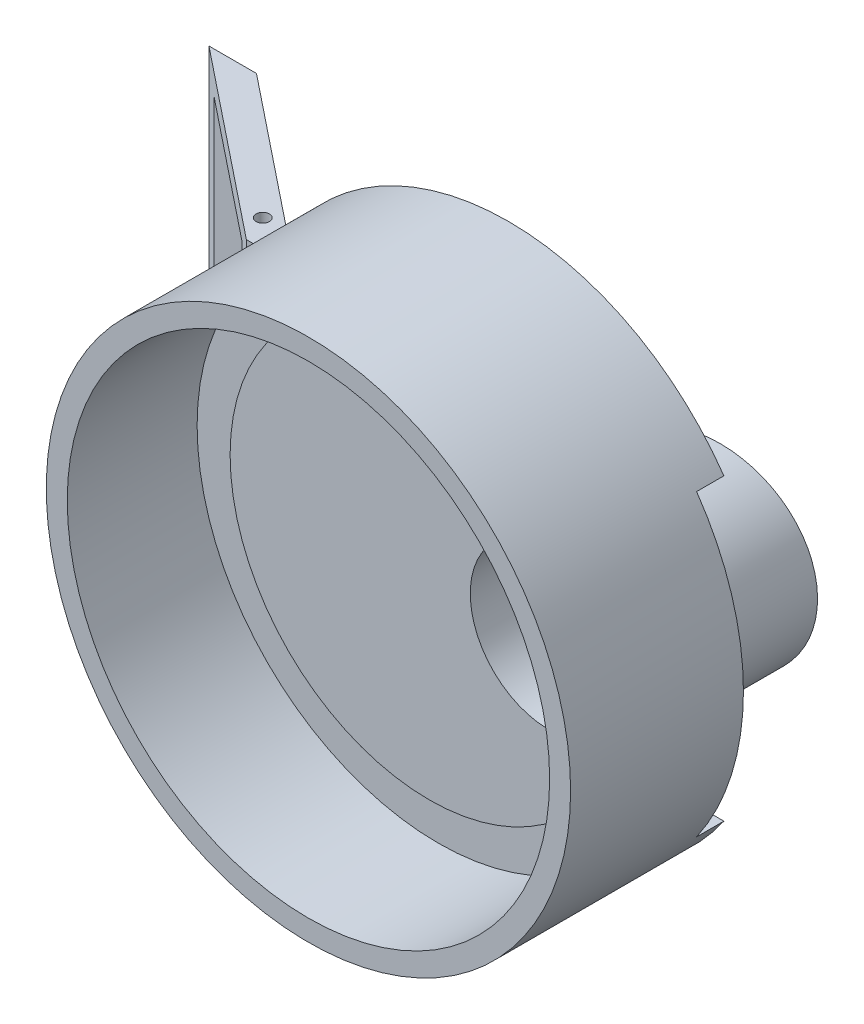
from build123d import *

# Parameters (mm, degrees)
SKETCH2_R                   = 9.525
LID_HOLE_DEPTH              = 50.8
SKETCH5_R                   = 12.065
LID_MOUTHPIECE_DEPTH        = 13.97
SKETCH6_R                   = 9.525
LID_HOLE_2_DEPTH            = 59.953263205
LID_HANDLE_DEPTH            = 13.97
SLOT_START                  = -3.302
SKETCH11_R                  = 12.065
SLOT_FOR_COVER_DEPTH        = 3.302
ANGLED_MOUTHPIECE_CUT_DEPTH = 12.7
CUT_EXTRUDE3_START          = -27.94
SKETCH15_R                  = 0.811013261
CUT_EXTRUDE3_DEPTH          = 27.94


with BuildPart() as part:
    # Sketch1 → Lid Shape (revolve)
    with BuildSketch(Plane(origin=(0, 0, 0), x_dir=(1, 0, 0), z_dir=(0, 1, 0))):
        Polygon((0, 50.10238266), (31.75, 50.10238266), (31.75, 25.87078266), (29.21, 25.87078266), (29.21, 40.51388266), (29.21, 41.597899191), (24.13, 41.597899191), (24.13, 40.51388266), (0, 40.51388266), align=None)
    revolve(axis=Axis((0, 0, 0), (0, 0, -1)))

    # Sketch2 → Lid Hole (cut)
    with BuildSketch(Plane.XY.offset(-40.51388266)):
        with Locations((14.478, 0)):
            Circle(SKETCH2_R)
    extrude(amount=-LID_HOLE_DEPTH, mode=Mode.SUBTRACT)

    # Sketch5 → Lid Mouthpiece (add)
    with BuildSketch(Plane(origin=(0, 0, -50.10238266), x_dir=(-1, 0, 0), z_dir=(0, 0, -1))):
        with Locations((-14.478, 0)):
            Circle(SKETCH5_R)
    extrude(amount=LID_MOUTHPIECE_DEPTH)

    # Sketch6 → Lid Hole 2 (cut, through all)
    with BuildSketch(Plane(origin=(0, 0, -64.07238266), x_dir=(-1, 0, 0), z_dir=(0, 0, -1))):
        with Locations(Location((-14.478, 0, 0), (0, 0, 180))):
            Circle(SKETCH6_R)
    extrude(amount=-LID_HOLE_2_DEPTH, mode=Mode.SUBTRACT)

    # Sketch8 → Lid Handle (add, symmetric)
    with BuildSketch(Plane(origin=(0, 0, 0), x_dir=(1, 0, 0), z_dir=(0, 1, 0))):
        Polygon((-31.75, 50.10238266), (-52.891013527, 66.999169477), (-54.31959445, 68.140951412), (-48.565910523, 68.140951412), (-25.996316072, 50.10238266), align=None)
    extrude(amount=LID_HANDLE_DEPTH, both=True)

    # Sketch9 → Handle Hole section 0
    with BuildSketch(Plane(origin=(14.301912302, 0, -17.894344333), x_dir=(-0.7811575478192837, 0, -0.6243339534936118), z_dir=(0.6243339534936119, 0, -0.7811575478192838))):
        with BuildLine():
            Line((55.080337161, 10.795), (76.670337161, 10.795))
            Line((76.670337161, 10.795), (76.670337161, -10.795))
            Line((76.670337161, -10.795), (55.080337161, -10.795))
            Line((55.080337161, -10.795), (55.080337161, 10.795))
        make_face()
    # Sketch10 → Handle Hole section 1
    with BuildSketch(Plane(origin=(12.059167241, 0, -15.088254384), x_dir=(0.7811575478192838, 0, 0.6243339534936119), z_dir=(-0.6243339534936118, 0, 0.7811575478192837))):
        with BuildLine():
            Line((-81.164870789, 11.43), (-59.574870789, 11.43))
            Line((-59.574870789, 11.43), (-59.574870789, -10.16))
            Line((-59.574870789, -10.16), (-81.164870789, -10.16))
            Line((-81.164870789, -10.16), (-81.164870789, 11.43))
        make_face()
    loft(mode=Mode.SUBTRACT)

    # Sketch11 → Slot for Cover (cut)
    with BuildSketch(Plane(origin=(0, 0, -50.10238266), x_dir=(-1, 0, 0), z_dir=(0, 0, -1)).offset(SLOT_START)):
        with BuildLine():
            ThreePointArc((28.511429287, 13.97), (27.373977798, 16.085019102), (26.079920429, 18.108016192))
            Line((26.079920429, 18.108016192), (-26.079920429, 18.108016192))
            ThreePointArc((-26.079920429, 18.108016192), (-30.299339709, 9.48749246), (-31.75, 0))
            ThreePointArc((-31.75, 0), (-30.299339709, -9.48749246), (-26.079920429, -18.108016192))
            Line((-26.079920429, -18.108016192), (26.079920429, -18.108016192))
            ThreePointArc((26.079920429, -18.108016192), (27.373977798, -16.085019102), (28.511429287, -13.97))
            Line((28.511429287, -13.97), (25.996316072, -13.97))
            Line((25.996316072, -13.97), (5.018618521, -13.97))
            Line((5.018618521, -13.97), (5.018618521, 13.97))
            Line((5.018618521, 13.97), (25.996316072, 13.97))
            Line((25.996316072, 13.97), (28.511429287, 13.97))
        make_face()
        with Locations((-14.478, 0)):
            Circle(SKETCH11_R, mode=Mode.SUBTRACT)
    extrude(amount=SLOT_FOR_COVER_DEPTH, mode=Mode.SUBTRACT)

    # Sketch12 → Angled Mouthpiece Cut (cut, symmetric)
    with BuildSketch(Plane(origin=(0, 0, 0), x_dir=(1, 0, 0), z_dir=(0, 1, 0))):
        Polygon((26.628471811, 67.14025983), (26.628471811, 60.995566014), (2.357445469, 57.350666014), (2.357445469, 67.14025983), align=None)
    extrude(amount=ANGLED_MOUTHPIECE_CUT_DEPTH, both=True, mode=Mode.SUBTRACT)

    # Sketch15 → Cut-Extrude3 (cut)
    with BuildSketch(Plane(origin=(0, 13.97, 0), x_dir=(1, 0, 0), z_dir=(0, 1, 0)).offset(CUT_EXTRUDE3_START)):
        with Locations(Location((-33.050089725, 53.387241314, 0), (0, 0, 231.366681908))):
            Circle(SKETCH15_R)
    extrude(amount=CUT_EXTRUDE3_DEPTH, mode=Mode.SUBTRACT)


solid = part.part
